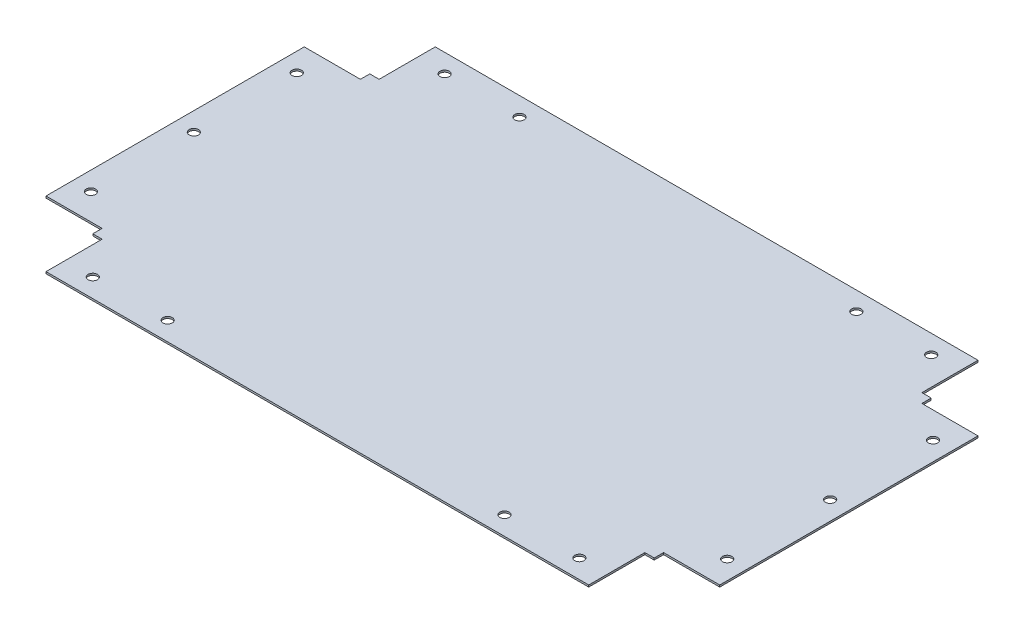
from build123d import *

# Parameters (mm, degrees)
SKETCH1_R           = 2.5
BOSS_EXTRUDE1_DEPTH = 1


with BuildPart() as part:
    # Sketch1 → Boss-Extrude1 (new body)
    with BuildSketch(Plane(origin=(0, 0, 0), x_dir=(1, 0, 0), z_dir=(0, 1, 0))):
        Polygon((0, 0), (0, 5), (-30, 5), (-30, 143), (0, 143), (0, 148), (5, 148), (5, 178), (295, 178), (295, 148), (300, 148), (300, 143), (330, 143), (330, 5), (300, 5), (300, 0), (295, 0), (295, -30), (5, -30), (5, 0), align=None)
        with Locations(Location((20, -20, 0), (0, 0, 270))):
            Circle(SKETCH1_R, mode=Mode.SUBTRACT)
        with Locations(Location((60, -20, 0), (0, 0, 270))):
            Circle(SKETCH1_R, mode=Mode.SUBTRACT)
        with Locations(Location((280, -20, 0), (0, 0, 270))):
            Circle(SKETCH1_R, mode=Mode.SUBTRACT)
        with Locations(Location((240, -20, 0), (0, 0, 270))):
            Circle(SKETCH1_R, mode=Mode.SUBTRACT)
        with Locations(Location((320, 19, 0), (0, 0, 270))):
            Circle(SKETCH1_R, mode=Mode.SUBTRACT)
        with Locations(Location((320, 129, 0), (0, 0, 270))):
            Circle(SKETCH1_R, mode=Mode.SUBTRACT)
        with Locations(Location((280, 168, 0), (0, 0, 270))):
            Circle(SKETCH1_R, mode=Mode.SUBTRACT)
        with Locations(Location((240, 168, 0), (0, 0, 270))):
            Circle(SKETCH1_R, mode=Mode.SUBTRACT)
        with Locations(Location((60, 168, 0), (0, 0, 270))):
            Circle(SKETCH1_R, mode=Mode.SUBTRACT)
        with Locations(Location((20, 168, 0), (0, 0, 270))):
            Circle(SKETCH1_R, mode=Mode.SUBTRACT)
        with Locations(Location((-20, 129, 0), (0, 0, 270))):
            Circle(SKETCH1_R, mode=Mode.SUBTRACT)
        with Locations(Location((-20, 19, 0), (0, 0, 270))):
            Circle(SKETCH1_R, mode=Mode.SUBTRACT)
        with Locations(Location((-20, 74, 0), (0, 0, 270))):
            Circle(SKETCH1_R, mode=Mode.SUBTRACT)
        with Locations(Location((320, 74, 0), (0, 0, 270))):
            Circle(SKETCH1_R, mode=Mode.SUBTRACT)
    extrude(amount=BOSS_EXTRUDE1_DEPTH)


solid = part.part
